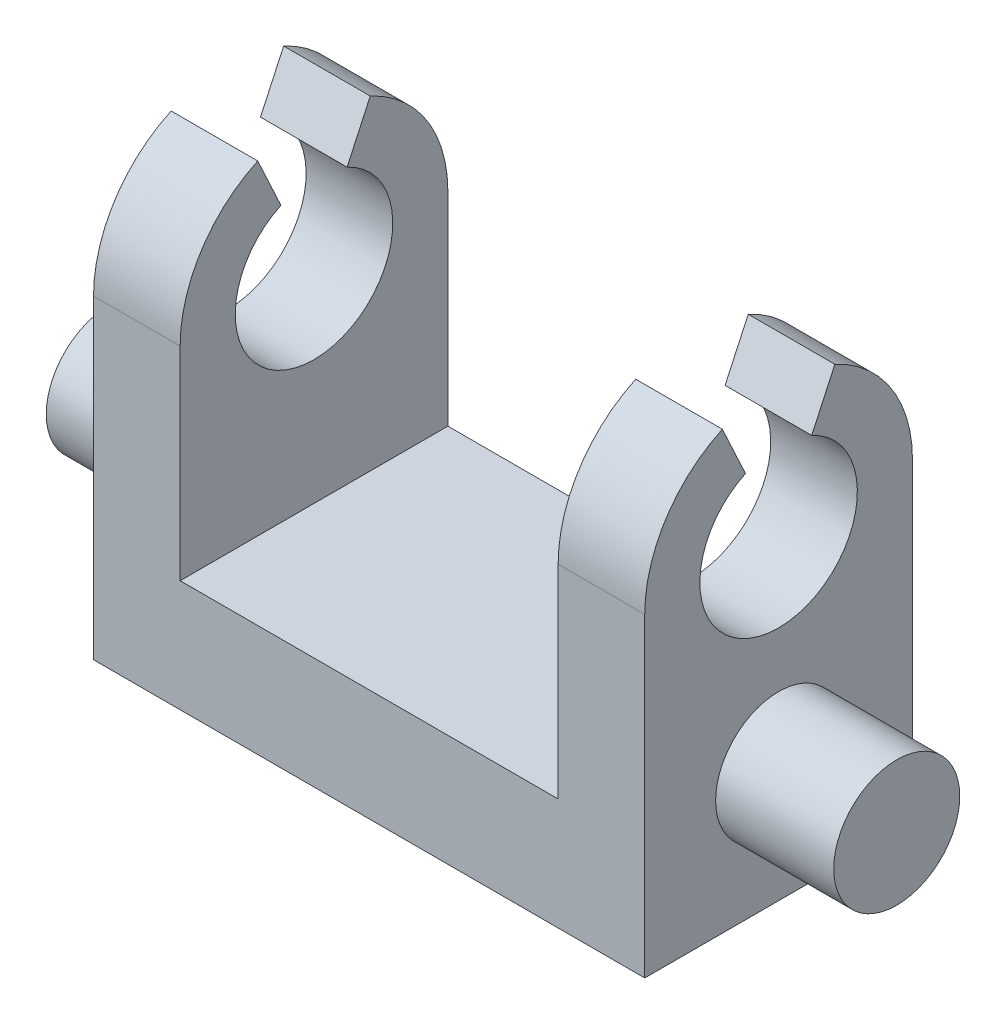
from build123d import *

# Parameters (mm, degrees)
SKETCH1_R           = 8
BOSS_EXTRUDE1_DEPTH = 50
SKETCH2_R           = 10
BOSS_EXTRUDE2_DEPTH = 35
SKETCH3_W           = 48
SKETCH3_H           = 42
CUT_EXTRUDE1_DEPTH  = 35
SKETCH4_W           = 48
SKETCH4_H           = 0.81
CUT_EXTRUDE2_DEPTH  = 74.620649277
CUT_EXTRUDE3_REACH  = 98.322


with BuildPart() as part:
    # Sketch1 → Boss-Extrude1 (new, symmetric)
    with BuildSketch(Plane(origin=(0, 0, 0), x_dir=(0, 0, -1), z_dir=(1, 0, 0))):
        Circle(SKETCH1_R)
    extrude(amount=BOSS_EXTRUDE1_DEPTH, both=True)

    # Sketch2 → Boss-Extrude2 (add, symmetric)
    with BuildSketch(Plane(origin=(0, 0, 0), x_dir=(0, 0, -1), z_dir=(1, 0, 0))):
        with BuildLine():
            Line((-17, 25), (-17, -15))
            Line((-17, -15), (17, -15))
            Line((17, -15), (17, 25))
            ThreePointArc((17, 25), (0, 42), (-17, 25))
        make_face()
        with Locations((0, 25)):
            Circle(SKETCH2_R, mode=Mode.SUBTRACT)
    extrude(amount=BOSS_EXTRUDE2_DEPTH, both=True)

    # Sketch3 → Cut-Extrude1 (cut, symmetric)
    with BuildSketch(Plane.XY):
        with Locations((0, 21)):
            Rectangle(SKETCH3_W, SKETCH3_H)
    extrude(amount=CUT_EXTRUDE1_DEPTH, both=True, mode=Mode.SUBTRACT)

    # Sketch4 → Cut-Extrude2 (cut, through all)
    with BuildSketch(Plane(origin=(0, 0, -17), x_dir=(-1, 0, 0), z_dir=(0, 0, -1))):
        with Locations((0, -0.405)):
            Rectangle(SKETCH4_W, SKETCH4_H)
    extrude(amount=-CUT_EXTRUDE2_DEPTH, mode=Mode.SUBTRACT)

    # Cut-Extrude3: up to this face of the body (flat: up to its plane)
    cut_extrude3_end = Plane(part.part.faces().sort_by_distance((35, 10.448870599, 0))[0])
    # Sketch5 → Cut-Extrude3 (cut, up to the picked face)
    with BuildSketch(Plane.ZY.offset(35), mode=Mode.PRIVATE) as cut_extrude3_sk1:
        with BuildLine():
            Line((-7.14443883, 40.425854719), (-4.202611077, 34.074032187))
            ThreePointArc((-4.202611077, 34.074032187), (0, 35), (4.202611077, 34.074032187))
            Line((4.202611077, 34.074032187), (7.14443883, 40.425854719))
            ThreePointArc((7.14443883, 40.425854719), (0, 42), (-7.14443883, 40.425854719))
        make_face()
    cut_extrude3_tool1 = split(extrude(cut_extrude3_sk1.sketch, amount=-CUT_EXTRUDE3_REACH, mode=Mode.PRIVATE), bisect_by=cut_extrude3_end, keep=Keep.BOTH, mode=Mode.PRIVATE)
    add(cut_extrude3_tool1.solids().sort_by(Axis((-35, 38.373758, 0), (1, 0, 0)))[0], mode=Mode.SUBTRACT)


solid = part.part
